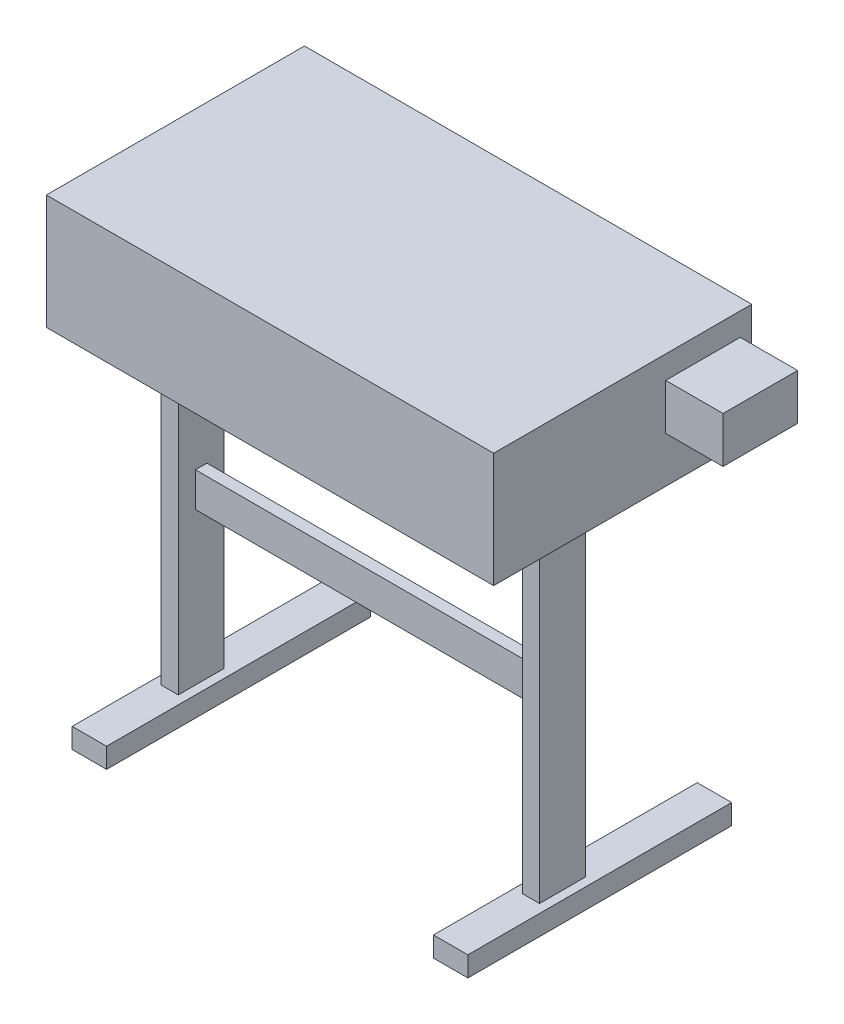
from build123d import *

# Parameters (mm, degrees)
SKETCH1_W             = 990.6
SKETCH1_H             = 571.5
BOSS_EXTRUDE1_DEPTH   = 254
SKETCH3_W             = 165.1
SKETCH3_H             = 101.6
BOSS_EXTRUDE2_DEPTH   = 127
SKETCH4_W             = 38.1
SKETCH4_H             = 101.6
BOSS_EXTRUDE3_DEPTH   = 781.05
BOSS_EXTRUDE3_2_DEPTH = 781.05
SKETCH5_W             = 25.4
SKETCH5_H             = 76.2
BOSS_EXTRUDE4_DEPTH   = 762
SKETCH6_W             = 76.2
SKETCH6_H             = 584.2
BOSS_EXTRUDE5_DEPTH   = 44.45


with BuildPart() as part:
    # Sketch1 → Boss-Extrude1 (new body)
    with BuildSketch(Plane(origin=(0, 0, 0), x_dir=(1, 0, 0), z_dir=(0, 1, 0))):
        with Locations((0, -285.75)):
            Rectangle(SKETCH1_W, SKETCH1_H)
    extrude(amount=BOSS_EXTRUDE1_DEPTH)

    # Sketch3 → Boss-Extrude2 (add)
    with BuildSketch(Plane(origin=(495.3, 0, 0), x_dir=(0, 0, -1), z_dir=(1, 0, 0))):
        with Locations((-107.95, 152.4)):
            Rectangle(SKETCH3_W, SKETCH3_H)
    extrude(amount=BOSS_EXTRUDE2_DEPTH)


with BuildPart() as body_2:
    # Sketch4 → Boss-Extrude3 (new body)
    with BuildSketch(Plane(origin=(0, 0, 0), x_dir=(1, 0, 0), z_dir=(0, 1, 0))):
        with Locations((400.05, -342.9)):
            Rectangle(SKETCH4_W, SKETCH4_H)
    extrude(amount=-BOSS_EXTRUDE3_DEPTH)



with BuildPart() as body_3:
    # Sketch4 → Boss-Extrude3 2 (new body)
    with BuildSketch(Plane(origin=(0, 0, 0), x_dir=(1, 0, 0), z_dir=(0, 1, 0))):
        with Locations((-400.05, -342.9)):
            Rectangle(SKETCH4_W, SKETCH4_H)
    extrude(amount=-BOSS_EXTRUDE3_2_DEPTH)


with BuildPart() as body_2_1:
    add(body_2.part)

    add(body_3.part)  # Boss-Extrude4 merges body 3
    # Sketch5 → Boss-Extrude4 (add)
    with BuildSketch(Plane.ZY.offset(-381)):
        with Locations((342.9, -361.95)):
            Rectangle(SKETCH5_W, SKETCH5_H)
    extrude(amount=BOSS_EXTRUDE4_DEPTH)

    # Sketch6 → Boss-Extrude5 (add)
    with BuildSketch(Plane.XZ.offset(781.05)):
        with Locations((400.05, 279.4)):
            Rectangle(SKETCH6_W, SKETCH6_H)
        with Locations((-400.05, 279.4)):
            Rectangle(SKETCH6_W, SKETCH6_H)
    extrude(amount=-BOSS_EXTRUDE5_DEPTH)


solid = Compound([part.part, body_2_1.part])
